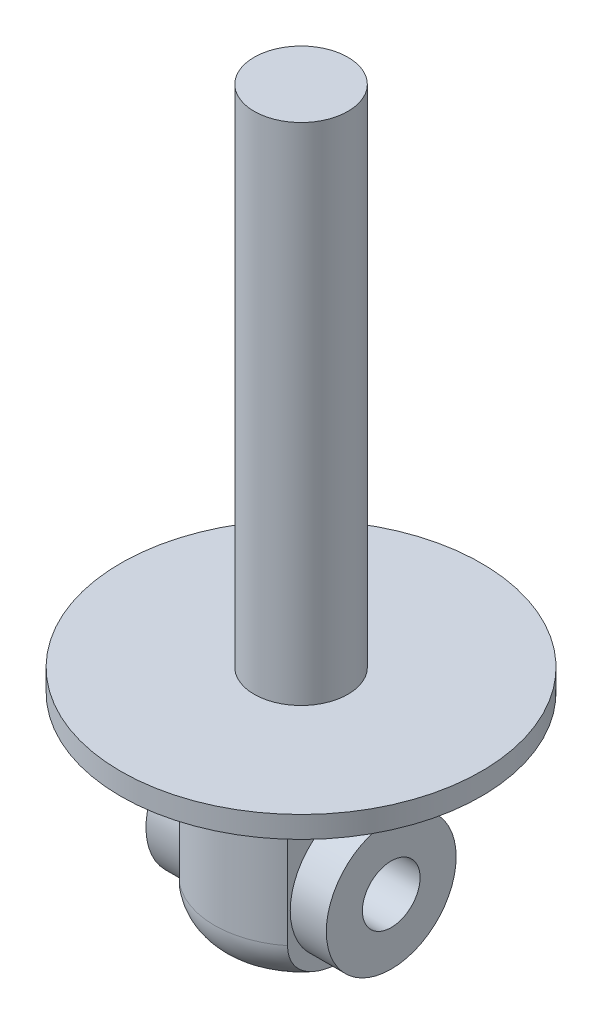
from build123d import *
from build123d.topology import SkipClean

# Parameters (mm, degrees)
SKETCH1_R               = 25
BOSS_EXTRUDE1_DEPTH     = 3
SKETCH2_R               = 6.5
BOSS_EXTRUDE2_DEPTH     = 70
SKETCH3_R               = 12
BOSS_EXTRUDE3_DEPTH     = 28
FILLET1_R               = 6
CUT_EXTRUDE1_DEPTH      = 82.111035008
CUT_EXTRUDE1_DEPTH_BACK = 82.111035008
SKETCH4_W               = 15
SKETCH4_H               = 20
CUT_EXTRUDE2_DEPTH      = 84.727235712
CUT_EXTRUDE2_DEPTH_BACK = 84.727235712
SKETCH5_R               = 4
SKETCH7_R               = 9
SKETCH7_R_2             = 4
BOSS_EXTRUDE4_DEPTH     = 12.5


with BuildPart() as part:
    # Sketch1 → Boss-Extrude1 (new body)
    with BuildSketch(Plane(origin=(0, 0, 0), x_dir=(1, 0, 0), z_dir=(0, 1, 0))):
        with Locations(Location((0, 0, 0), (0, 0, 270))):
            Circle(SKETCH1_R)
    extrude(amount=BOSS_EXTRUDE1_DEPTH)

    # Sketch2 → Boss-Extrude2 (add)
    with BuildSketch(Plane(origin=(0, 3, 0), x_dir=(1, 0, 0), z_dir=(0, 1, 0))):
        with Locations(Location((0, 0, 0), (0, 0, 270))):
            Circle(SKETCH2_R)
    extrude(amount=BOSS_EXTRUDE2_DEPTH)

    # Sketch3 → Boss-Extrude3 (add)
    with BuildSketch(Plane.XZ):
        with Locations(Location((0, 0, 0), (0, 0, 90))):
            Circle(SKETCH3_R)
    extrude(amount=BOSS_EXTRUDE3_DEPTH)

    # Fillet1
    fillet1_edges = [part.edges().sort_by_distance(p)[0] for p in [
        (0, -28, -12),
    ]]
    fillet(fillet1_edges, radius=FILLET1_R)

    # Sketch4 → Cut-Extrude1 (cut, two sides: drawn at the far end of the back side and taken through both)
    with BuildSketch(Plane.XY.offset(-CUT_EXTRUDE1_DEPTH_BACK)):
        with Locations((-15, -18)):
            Rectangle(SKETCH4_W, SKETCH4_H)
        with Locations((15, -18)):
            Rectangle(SKETCH4_W, SKETCH4_H)
    extrude(amount=CUT_EXTRUDE1_DEPTH + CUT_EXTRUDE1_DEPTH_BACK, mode=Mode.SUBTRACT)

    # Sketch5 → Cut-Extrude2 (cut, two sides: drawn at the far end of the back side and taken through both)
    with BuildSketch(Plane(origin=(7.5, 0, 0), x_dir=(0, 0, -1), z_dir=(1, 0, 0)).offset(-CUT_EXTRUDE2_DEPTH_BACK)):
        with Locations(Location((0, -18, 0), (0, 0, 90))):
            Circle(SKETCH5_R)
    extrude(amount=CUT_EXTRUDE2_DEPTH + CUT_EXTRUDE2_DEPTH_BACK, mode=Mode.SUBTRACT)

    # Sketch7 → Boss-Extrude4 (add, symmetric)
    with SkipClean():  # the faces are left unmerged after this step: merging them gives an invalid solid
        with BuildSketch(Plane(origin=(0, 0, 0), x_dir=(0, 0, -1), z_dir=(1, 0, 0))):
            with Locations(Location((0, -18, 0), (0, 0, 90))):
                Circle(SKETCH7_R)
            with Locations((0, -18)):
                Circle(SKETCH7_R_2, mode=Mode.SUBTRACT)
        extrude(amount=BOSS_EXTRUDE4_DEPTH, both=True)


solid = part.part
